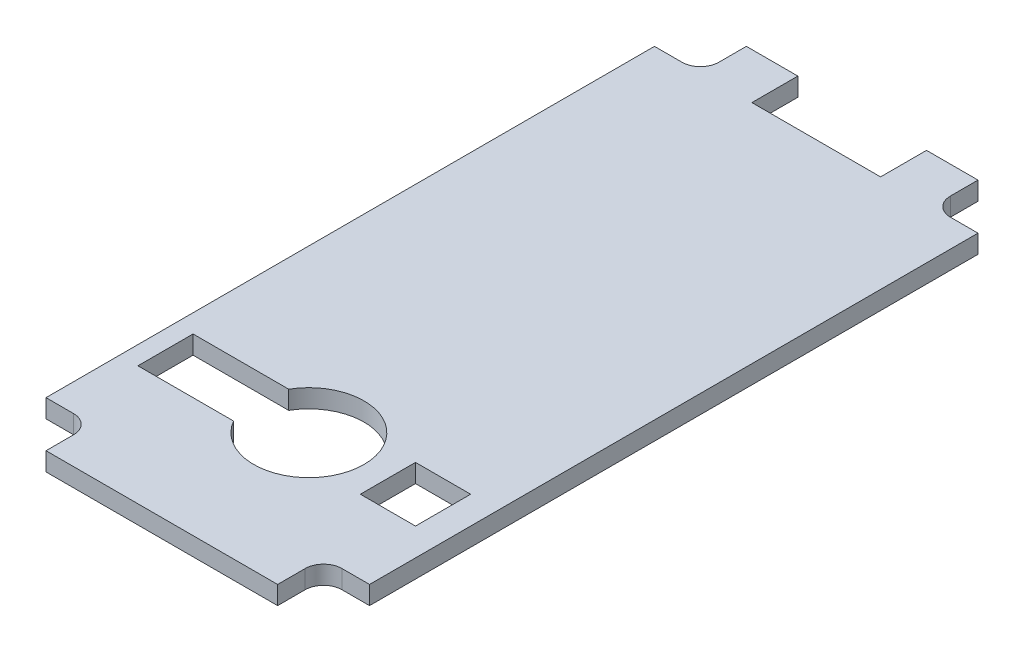
from build123d import *

# Parameters (mm, degrees)
SKETCH_2_W          = 17.6
SKETCH_2_H          = 38.1
EXTRUDE_2_DEPTH     = 1
CUT_EXTRUDE_3_REACH = 23.008
SKETCH_3_W          = 7
SKETCH_3_H          = 2.5
SKETCH_3_W_2        = 3
SKETCH_3_H_2        = 3


with BuildPart() as part:
    # 草圖2 → 伸長2 (new body)
    with BuildSketch(Plane(origin=(0, 0, 0), x_dir=(1, 0, 0), z_dir=(0, 1, 0))):
        Rectangle(SKETCH_2_W, SKETCH_2_H)
    extrude(amount=EXTRUDE_2_DEPTH)

    # 草圖3 → 伸長3 (cut, up to next)
    with BuildSketch(Plane(origin=(0, 1, 0), x_dir=(1, 0, 0), z_dir=(0, 1, 0)), mode=Mode.PRIVATE) as cut_extrude_3_sk1:
        with Locations((0, 17.8)):
            Rectangle(SKETCH_3_W, SKETCH_3_H)
    cut_extrude_3_tool1 = extrude(cut_extrude_3_sk1.sketch, amount=-CUT_EXTRUDE_3_REACH, mode=Mode.PRIVATE) & part.part
    # 草圖3 → 伸長3 (cut, up to next)
    with BuildSketch(Plane(origin=(0, 1, 0), x_dir=(1, 0, 0), z_dir=(0, 1, 0)), mode=Mode.PRIVATE) as cut_extrude_3_sk2:
        with BuildLine():
            Line((8.8, 19.05), (6.3, 19.05))
            Line((6.3, 19.05), (6.3, 17.55))
            ThreePointArc((6.3, 17.55), (6.592893219, 16.842893219), (7.3, 16.55))
            Line((7.3, 16.55), (8.8, 16.55))
            Line((8.8, 16.55), (8.8, 19.05))
        make_face()
    cut_extrude_3_tool2 = extrude(cut_extrude_3_sk2.sketch, amount=-CUT_EXTRUDE_3_REACH, mode=Mode.PRIVATE) & part.part
    # 草圖3 → 伸長3 (cut, up to next)
    with BuildSketch(Plane(origin=(0, 1, 0), x_dir=(1, 0, 0), z_dir=(0, 1, 0)), mode=Mode.PRIVATE) as cut_extrude_3_sk3:
        with BuildLine():
            Line((-8.8, 19.05), (-6.3, 19.05))
            Line((-6.3, 19.05), (-6.3, 17.55))
            ThreePointArc((-6.3, 17.55), (-6.592893219, 16.842893219), (-7.3, 16.55))
            Line((-7.3, 16.55), (-8.8, 16.55))
            Line((-8.8, 16.55), (-8.8, 19.05))
        make_face()
    cut_extrude_3_tool3 = extrude(cut_extrude_3_sk3.sketch, amount=-CUT_EXTRUDE_3_REACH, mode=Mode.PRIVATE) & part.part
    # 草圖3 → 伸長3 (cut, up to next)
    with BuildSketch(Plane(origin=(0, 1, 0), x_dir=(1, 0, 0), z_dir=(0, 1, 0)), mode=Mode.PRIVATE) as cut_extrude_3_sk4:
        with BuildLine():
            Line((-8.8, -19.05), (-6.3, -19.05))
            Line((-6.3, -19.05), (-6.3, -17.55))
            ThreePointArc((-6.3, -17.55), (-6.592893219, -16.842893219), (-7.3, -16.55))
            Line((-7.3, -16.55), (-8.8, -16.55))
            Line((-8.8, -16.55), (-8.8, -19.05))
        make_face()
    cut_extrude_3_tool4 = extrude(cut_extrude_3_sk4.sketch, amount=-CUT_EXTRUDE_3_REACH, mode=Mode.PRIVATE) & part.part
    # 草圖3 → 伸長3 (cut, up to next)
    with BuildSketch(Plane(origin=(0, 1, 0), x_dir=(1, 0, 0), z_dir=(0, 1, 0)), mode=Mode.PRIVATE) as cut_extrude_3_sk5:
        with BuildLine():
            Line((7.3, -16.55), (8.8, -16.55))
            Line((8.8, -16.55), (8.8, -19.05))
            Line((8.8, -19.05), (6.3, -19.05))
            Line((6.3, -19.05), (6.3, -17.55))
            ThreePointArc((6.3, -17.55), (6.592893219, -16.842893219), (7.3, -16.55))
        make_face()
    cut_extrude_3_tool5 = extrude(cut_extrude_3_sk5.sketch, amount=-CUT_EXTRUDE_3_REACH, mode=Mode.PRIVATE) & part.part
    # 草圖3 → 伸長3 (cut, up to next)
    with BuildSketch(Plane(origin=(0, 1, 0), x_dir=(1, 0, 0), z_dir=(0, 1, 0)), mode=Mode.PRIVATE) as cut_extrude_3_sk6:
        with BuildLine():
            Line((-7.8, -9.55), (-2.598076211, -9.55))
            ThreePointArc((-2.598076211, -9.55), (3, -11.05), (-2.598076211, -12.55))
            Line((-2.598076211, -12.55), (-7.8, -12.55))
            Line((-7.8, -12.55), (-7.8, -9.55))
        make_face()
    cut_extrude_3_tool6 = extrude(cut_extrude_3_sk6.sketch, amount=-CUT_EXTRUDE_3_REACH, mode=Mode.PRIVATE) & part.part
    # 草圖3 → 伸長3 (cut, up to next)
    with BuildSketch(Plane(origin=(0, 1, 0), x_dir=(1, 0, 0), z_dir=(0, 1, 0)), mode=Mode.PRIVATE) as cut_extrude_3_sk7:
        with Locations((5.8, -11.05)):
            Rectangle(SKETCH_3_W_2, SKETCH_3_H_2)
    cut_extrude_3_tool7 = extrude(cut_extrude_3_sk7.sketch, amount=-CUT_EXTRUDE_3_REACH, mode=Mode.PRIVATE) & part.part
    add(cut_extrude_3_tool1.solids().sort_by_distance((0, 1, -17.8))[0], mode=Mode.SUBTRACT)
    add(cut_extrude_3_tool2.solids().sort_by_distance((7.586504, 1, -17.836504))[0], mode=Mode.SUBTRACT)
    add(cut_extrude_3_tool3.solids().sort_by_distance((-7.586504, 1, -17.836504))[0], mode=Mode.SUBTRACT)
    add(cut_extrude_3_tool4.solids().sort_by_distance((-7.586504, 1, 17.836504))[0], mode=Mode.SUBTRACT)
    add(cut_extrude_3_tool5.solids().sort_by_distance((7.586504, 1, 17.836504))[0], mode=Mode.SUBTRACT)
    add(cut_extrude_3_tool6.solids().sort_by_distance((-1.831773, 1, 11.05))[0], mode=Mode.SUBTRACT)
    add(cut_extrude_3_tool7.solids().sort_by_distance((5.8, 1, 11.05))[0], mode=Mode.SUBTRACT)


solid = part.part
